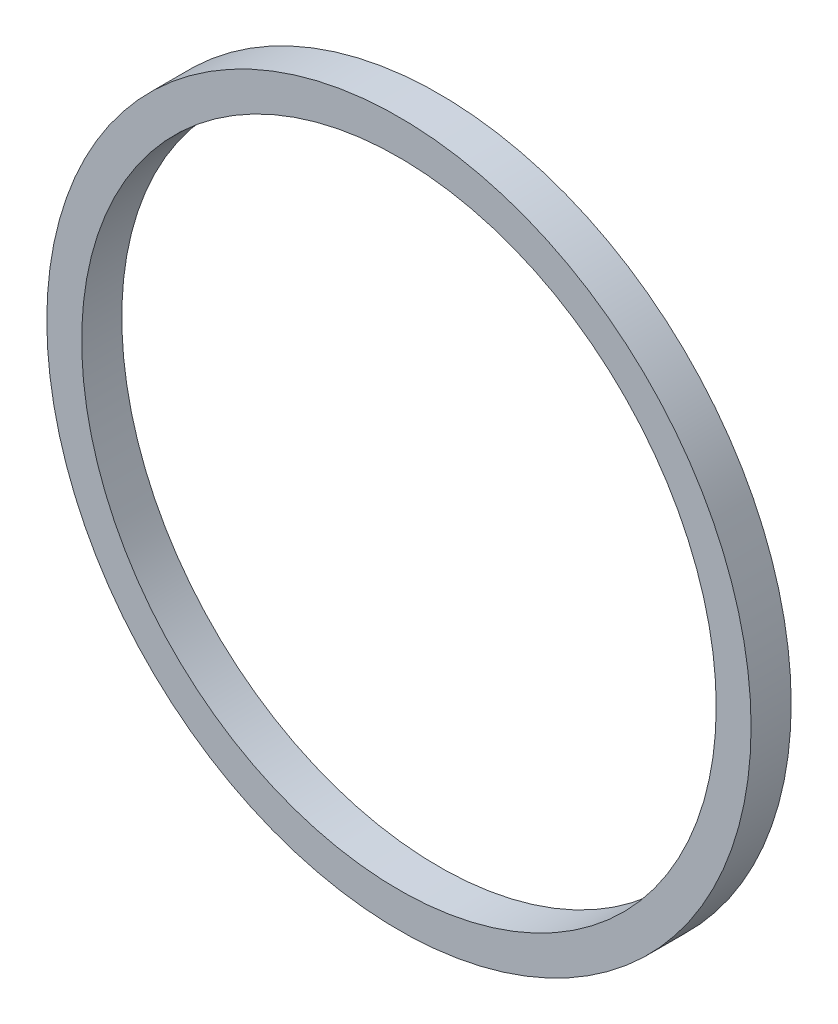
from build123d import *

# Parameters (mm, degrees)
SKETCH1_R           = 10.1
BOSS_EXTRUDE1_DEPTH = 1.15
SKETCH2_R           = 9.1
CUT_EXTRUDE1_DEPTH  = 1.15


with BuildPart() as part:
    # Sketch1 → Boss-Extrude1 (new body)
    with BuildSketch(Plane.XY):
        Circle(SKETCH1_R)
    extrude(amount=BOSS_EXTRUDE1_DEPTH)

    # Sketch2 → Cut-Extrude1 (cut)
    with BuildSketch(Plane.XY.offset(1.15)):
        Circle(SKETCH2_R)
    extrude(amount=-CUT_EXTRUDE1_DEPTH, mode=Mode.SUBTRACT)


solid = part.part
